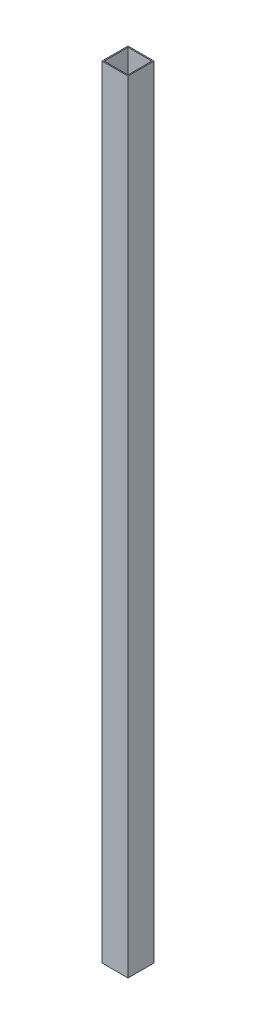
from build123d import *

# Parameters (mm, degrees)
SKETCH1_W           = 25
SKETCH1_H           = 25
SKETCH1_W_2         = 23
SKETCH1_H_2         = 23
BOSS_EXTRUDE1_DEPTH = 750


with BuildPart() as part:
    # Sketch1 → Boss-Extrude1 (new body)
    with BuildSketch(Plane(origin=(0, 0, 0), x_dir=(1, 0, 0), z_dir=(0, 1, 0))):
        Rectangle(SKETCH1_W, SKETCH1_H)
        Rectangle(SKETCH1_W_2, SKETCH1_H_2, mode=Mode.SUBTRACT)
    extrude(amount=BOSS_EXTRUDE1_DEPTH)


solid = part.part
